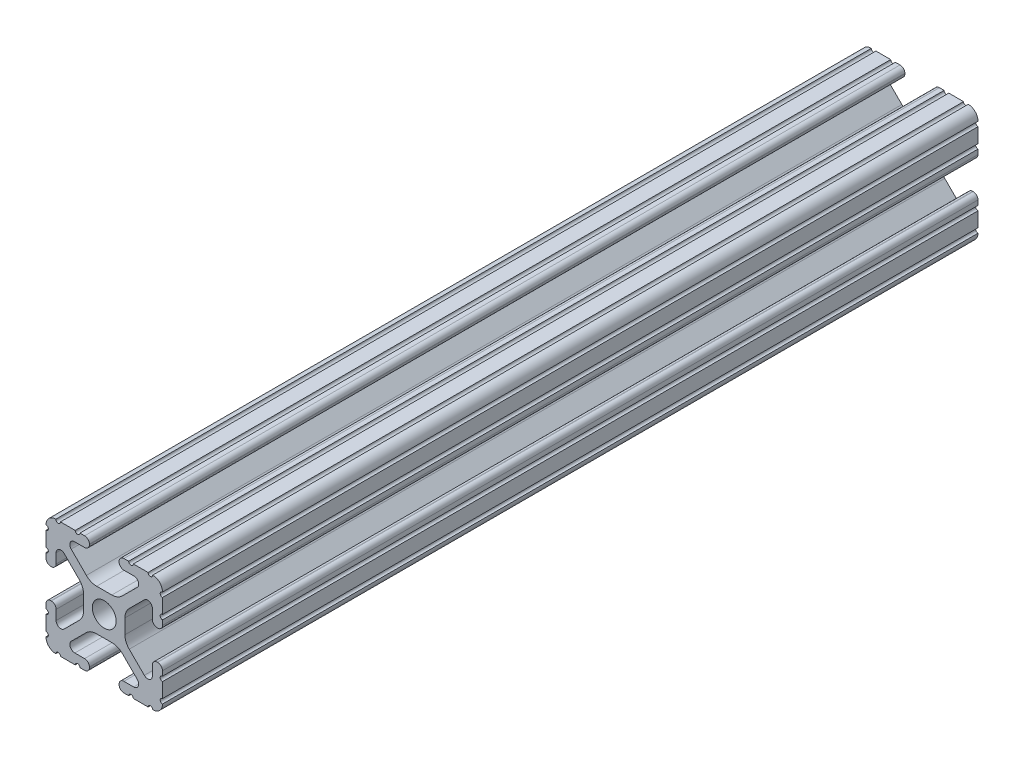
from build123d import *

# Parameters (mm, degrees)
SKETCH1_R           = 2.6035
BOSS_EXTRUDE1_DEPTH = 88.9


with BuildPart() as part:
    # Sketch1 → Boss-Extrude1 (new, symmetric)
    with BuildSketch(Plane.XY):
        with BuildLine():
            Line((-7.179650497, -8.645192506), (-3.952270251, -5.423690499))
            ThreePointArc((-3.952270251, -5.423690499), (-2.922936451, -4.736929036), (-1.709253557, -4.4958))
            Line((-1.709253557, -4.4958), (1.709253557, -4.4958))
            ThreePointArc((1.709253557, -4.4958), (2.922936451, -4.736929036), (3.952270251, -5.423690499))
            Line((3.952270251, -5.423690499), (7.179650497, -8.645192506))
            ThreePointArc((7.179650497, -8.645192506), (7.41473083, -9.822813117), (6.416408329, -10.4902))
            Line((6.416408329, -10.4902), (4.287512407, -10.4902))
            ThreePointArc((4.287512407, -10.4902), (3.54574862, -10.79744862), (3.2385, -11.539212407))
            Line((3.2385, -11.539212407), (3.2385, -11.650987593))
            ThreePointArc((3.2385, -11.650987593), (3.54574862, -12.39275138), (4.287512407, -12.7))
            Line((4.287512407, -12.7), (5.317126718, -12.7))
            ThreePointArc((5.317126718, -12.7), (5.825126718, -12.192), (6.333126718, -12.7))
            Line((6.333126718, -12.7), (9.550443118, -12.7))
            ThreePointArc((9.550443118, -12.7), (10.058366869, -12.192000006), (10.566443095, -12.699847501))
            ThreePointArc((10.566443095, -12.699847501), (12.082537762, -12.08250727), (12.699846982, -10.566399977))
            ThreePointArc((12.699846982, -10.566399977), (12.192000006, -10.058323491), (12.7, -9.5504))
            Line((12.7, -9.5504), (12.7, -6.3330836))
            ThreePointArc((12.7, -6.3330836), (12.192, -5.8250836), (12.7, -5.3170836))
            Line((12.7, -5.3170836), (12.7, -4.287469289))
            ThreePointArc((12.7, -4.287469289), (12.39275138, -3.545705502), (11.650987593, -3.238456882))
            Line((11.650987593, -3.238456882), (11.539212407, -3.238456882))
            ThreePointArc((11.539212407, -3.238456882), (10.79744862, -3.545705502), (10.4902, -4.287469289))
            Line((10.4902, -4.287469289), (10.4902, -6.402089023))
            ThreePointArc((10.4902, -6.402089023), (9.856505071, -7.351067942), (8.737131347, -7.129408934))
            Line((8.737131347, -7.129408934), (5.441005833, -3.840816462))
            ThreePointArc((5.441005833, -3.840816462), (4.750877967, -2.809883091), (4.5085, -1.593185507))
            Line((4.5085, -1.593185507), (4.5085, 1.593185507))
            ThreePointArc((4.5085, 1.593185507), (4.750877967, 2.809883091), (5.441005833, 3.840816462))
            Line((5.441005833, 3.840816462), (8.737131347, 7.129408934))
            ThreePointArc((8.737131347, 7.129408934), (9.856505071, 7.351067942), (10.4902, 6.402089023))
            Line((10.4902, 6.402089023), (10.4902, 4.287469289))
            ThreePointArc((10.4902, 4.287469289), (10.79744862, 3.545705502), (11.539212407, 3.238456882))
            Line((11.539212407, 3.238456882), (11.650987593, 3.238456882))
            ThreePointArc((11.650987593, 3.238456882), (12.39275138, 3.545705502), (12.7, 4.287469289))
            Line((12.7, 4.287469289), (12.7, 5.3170836))
            ThreePointArc((12.7, 5.3170836), (12.192, 5.8250836), (12.7, 6.3330836))
            Line((12.7, 6.3330836), (12.7, 9.5504))
            ThreePointArc((12.7, 9.5504), (12.192000006, 10.058323491), (12.699846982, 10.566399977))
            ThreePointArc((12.699846982, 10.566399977), (12.082537762, 12.08250727), (10.566443095, 12.699847501))
            ThreePointArc((10.566443095, 12.699847501), (10.058366869, 12.192000006), (9.550443118, 12.7))
            Line((9.550443118, 12.7), (6.333126718, 12.7))
            ThreePointArc((6.333126718, 12.7), (5.825126718, 12.192), (5.317126718, 12.7))
            Line((5.317126718, 12.7), (4.287512407, 12.7))
            ThreePointArc((4.287512407, 12.7), (3.54574862, 12.39275138), (3.2385, 11.650987593))
            Line((3.2385, 11.650987593), (3.2385, 11.539212407))
            ThreePointArc((3.2385, 11.539212407), (3.54574862, 10.79744862), (4.287512407, 10.4902))
            Line((4.287512407, 10.4902), (6.476788598, 10.4902))
            ThreePointArc((6.476788598, 10.4902), (7.432222385, 9.85140422), (7.207036008, 8.724370562))
            Line((7.207036008, 8.724370562), (3.898272566, 5.423169045))
            ThreePointArc((3.898272566, 5.423169045), (2.869120213, 4.736787962), (1.655778399, 4.4958))
            Line((1.655778399, 4.4958), (-1.655778399, 4.4958))
            ThreePointArc((-1.655778399, 4.4958), (-2.869120213, 4.736787962), (-3.898272566, 5.423169045))
            Line((-3.898272566, 5.423169045), (-7.207036008, 8.724370562))
            ThreePointArc((-7.207036008, 8.724370562), (-7.432222385, 9.85140422), (-6.476788598, 10.4902))
            Line((-6.476788598, 10.4902), (-4.287512407, 10.4902))
            ThreePointArc((-4.287512407, 10.4902), (-3.54574862, 10.79744862), (-3.2385, 11.539212407))
            Line((-3.2385, 11.539212407), (-3.2385, 11.650987593))
            ThreePointArc((-3.2385, 11.650987593), (-3.54574862, 12.39275138), (-4.287512407, 12.7))
            Line((-4.287512407, 12.7), (-5.317126718, 12.7))
            ThreePointArc((-5.317126718, 12.7), (-5.825126718, 12.192), (-6.333126718, 12.7))
            Line((-6.333126718, 12.7), (-9.550443118, 12.7))
            ThreePointArc((-9.550443118, 12.7), (-10.058366869, 12.192000006), (-10.566443095, 12.699847501))
            ThreePointArc((-10.566443095, 12.699847501), (-12.082537762, 12.08250727), (-12.699846982, 10.566399977))
            ThreePointArc((-12.699846982, 10.566399977), (-12.192000006, 10.058323491), (-12.7, 9.5504))
            Line((-12.7, 9.5504), (-12.7, 6.3330836))
            ThreePointArc((-12.7, 6.3330836), (-12.192, 5.8250836), (-12.7, 5.3170836))
            Line((-12.7, 5.3170836), (-12.7, 4.287469289))
            ThreePointArc((-12.7, 4.287469289), (-12.39275138, 3.545705502), (-11.650987593, 3.238456882))
            Line((-11.650987593, 3.238456882), (-11.539212407, 3.238456882))
            ThreePointArc((-11.539212407, 3.238456882), (-10.79744862, 3.545705502), (-10.4902, 4.287469289))
            Line((-10.4902, 4.287469289), (-10.4902, 6.402089023))
            ThreePointArc((-10.4902, 6.402089023), (-9.856505071, 7.351067942), (-8.737131347, 7.129408934))
            Line((-8.737131347, 7.129408934), (-5.441005833, 3.840816462))
            ThreePointArc((-5.441005833, 3.840816462), (-4.750877967, 2.809883091), (-4.5085, 1.593185507))
            Line((-4.5085, 1.593185507), (-4.5085, -1.593185507))
            ThreePointArc((-4.5085, -1.593185507), (-4.750877967, -2.809883091), (-5.441005833, -3.840816462))
            Line((-5.441005833, -3.840816462), (-8.737131347, -7.129408934))
            ThreePointArc((-8.737131347, -7.129408934), (-9.856505071, -7.351067942), (-10.4902, -6.402089023))
            Line((-10.4902, -6.402089023), (-10.4902, -4.287469289))
            ThreePointArc((-10.4902, -4.287469289), (-10.79744862, -3.545705502), (-11.539212407, -3.238456882))
            Line((-11.539212407, -3.238456882), (-11.650987593, -3.238456882))
            ThreePointArc((-11.650987593, -3.238456882), (-12.39275138, -3.545705502), (-12.7, -4.287469289))
            Line((-12.7, -4.287469289), (-12.7, -5.3170836))
            ThreePointArc((-12.7, -5.3170836), (-12.192, -5.8250836), (-12.7, -6.3330836))
            Line((-12.7, -6.3330836), (-12.7, -9.5504))
            ThreePointArc((-12.7, -9.5504), (-12.192000006, -10.058323491), (-12.699846982, -10.566399977))
            ThreePointArc((-12.699846982, -10.566399977), (-12.082537762, -12.08250727), (-10.566443095, -12.699847501))
            ThreePointArc((-10.566443095, -12.699847501), (-10.058366869, -12.192000006), (-9.550443118, -12.7))
            Line((-9.550443118, -12.7), (-6.333126718, -12.7))
            ThreePointArc((-6.333126718, -12.7), (-5.825126718, -12.192), (-5.317126718, -12.7))
            Line((-5.317126718, -12.7), (-4.287512407, -12.7))
            ThreePointArc((-4.287512407, -12.7), (-3.54574862, -12.39275138), (-3.2385, -11.650987593))
            Line((-3.2385, -11.650987593), (-3.2385, -11.539212407))
            ThreePointArc((-3.2385, -11.539212407), (-3.54574862, -10.79744862), (-4.287512407, -10.4902))
            Line((-4.287512407, -10.4902), (-6.416408329, -10.4902))
            ThreePointArc((-6.416408329, -10.4902), (-7.41473083, -9.822813117), (-7.179650497, -8.645192506))
        make_face()
        Circle(SKETCH1_R, mode=Mode.SUBTRACT)
    extrude(amount=BOSS_EXTRUDE1_DEPTH, both=True)


solid = part.part
